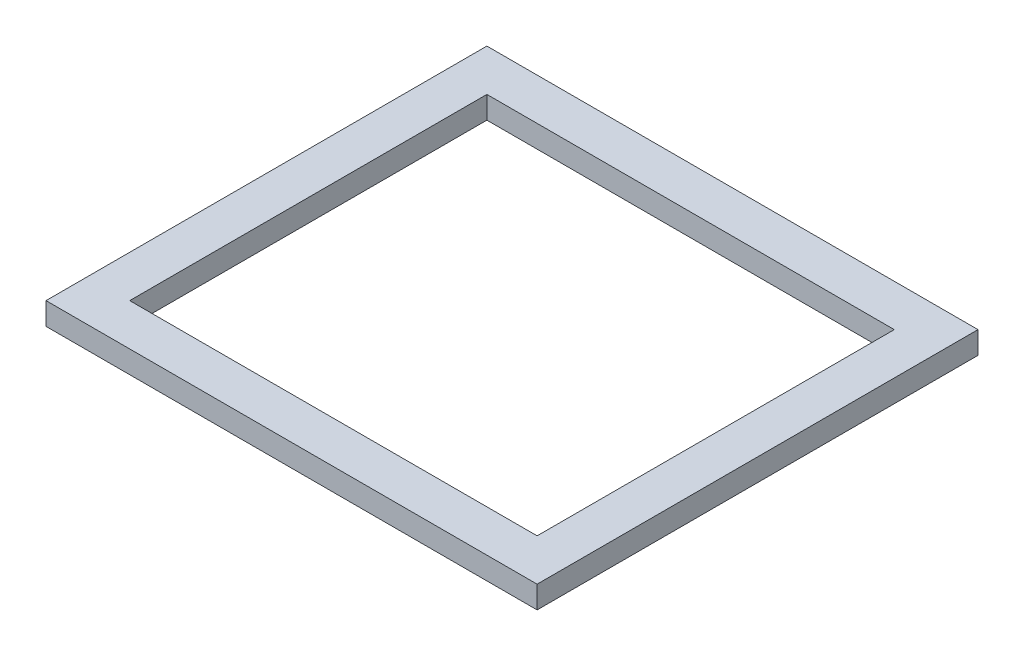
from build123d import *

# Parameters (mm, degrees)
SKETCH1_W           = 17.6
SKETCH1_H           = 15.8
SKETCH1_W_2         = 14.6
SKETCH1_H_2         = 12.8
EXTRUDE_THIN1_DEPTH = 0.8


with BuildPart() as part:
    # Sketch1 → Extrude-Thin1 (new body)
    with BuildSketch(Plane(origin=(0, 0, 0), x_dir=(1, 0, 0), z_dir=(0, 1, 0))):
        Rectangle(SKETCH1_W, SKETCH1_H)
        Rectangle(SKETCH1_W_2, SKETCH1_H_2, mode=Mode.SUBTRACT)
    extrude(amount=EXTRUDE_THIN1_DEPTH)


solid = part.part
